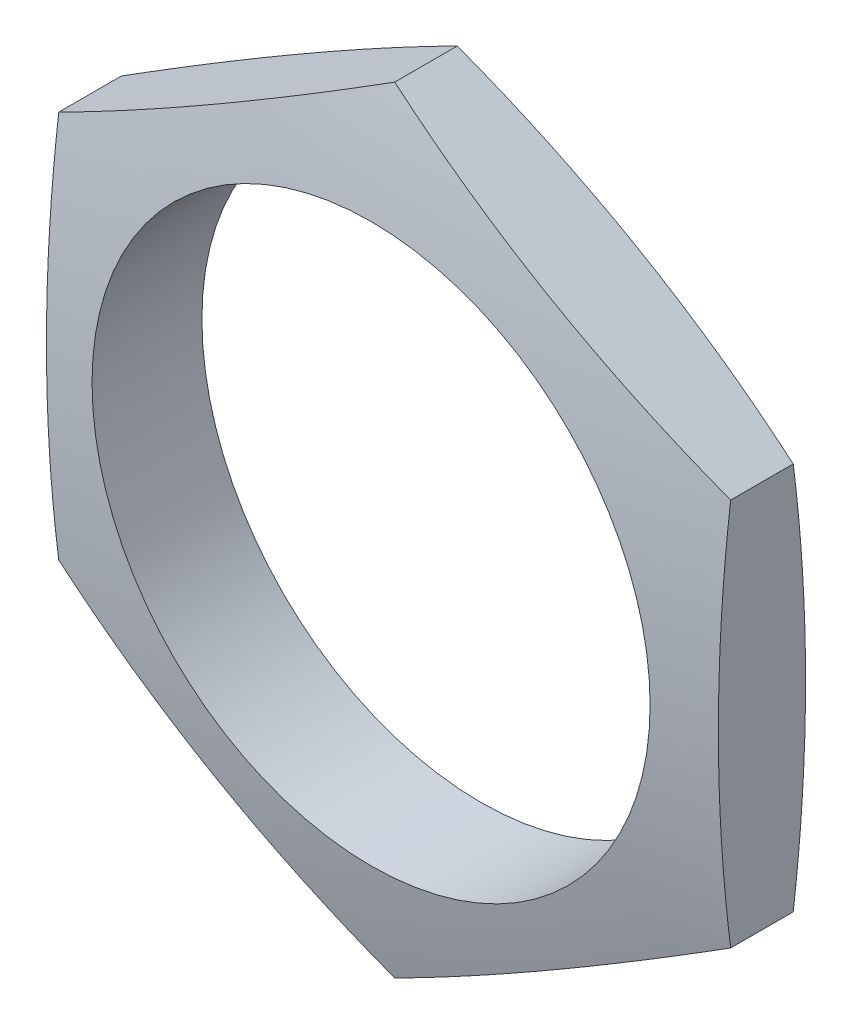
from build123d import *

# Parameters (mm, degrees)
BOSS_EXTRUDE1_DEPTH     = 2.8
F_1_2_20_TAPPED_HOLE1_D = 11.50874


with BuildPart() as part:
    # Sketch1 → Boss-Extrude1 (new body)
    with BuildSketch(Plane.XY):
        Polygon((0, 8), (-6.92820323, 4), (-6.92820323, -4), (0, -8), (6.92820323, -4), (6.92820323, 4), align=None)
    extrude(amount=BOSS_EXTRUDE1_DEPTH)

    # 1/2-20 Tapped Hole1 (through all)
    with Locations(Plane.XY.offset(2.8)):
        with Locations((0, 0)):
            Hole(F_1_2_20_TAPPED_HOLE1_D / 2)

    # Sketch6 → Cut-Revolve4 (revolve, cut)
    with BuildSketch(Plane(origin=(0, 0, 0), x_dir=(0, 0, -1), z_dir=(1, 0, 0))):
        with BuildLine():
            Line((-3.556750554, -8.169183417), (-3.141854791, -1.510155907))
            Line((-3.141854791, -1.510155907), (-3.012564121, -1.510155907))
            ThreePointArc((-3.012564121, -1.510155907), (-2.693421742, -4.779625328), (-2.04498583, -8))
            ThreePointArc((-2.04498583, -8), (-2.70372151, -8.952660986), (-3.556750554, -8.169183417))
        make_face()
        with BuildLine():
            Line((0.212564121, -1.510155907), (0.341854791, -1.510155907))
            Line((0.341854791, -1.510155907), (0.756750554, -8.169183417))
            ThreePointArc((0.756750554, -8.169183417), (-0.09627849, -8.952660986), (-0.75501417, -8))
            ThreePointArc((-0.75501417, -8), (-0.106578258, -4.779625328), (0.212564121, -1.510155907))
        make_face()
    revolve(axis=Axis((0, 0, 0), (0, 0, 1)), mode=Mode.SUBTRACT)


solid = part.part
